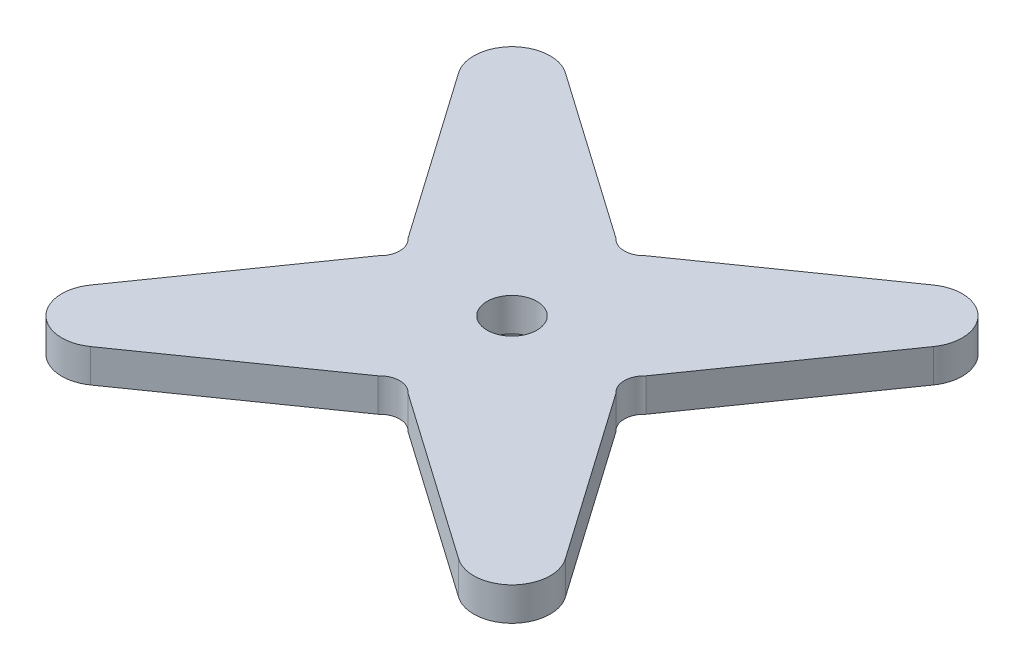
from build123d import *

# Parameters (mm, degrees)
BOSS_EXTRUDE1_DEPTH = 2
SKETCH2_R           = 4
SKETCH2_R_2         = 3
BOSS_EXTRUDE2_DEPTH = 3.5
FILLET1_R           = 2.5
SKETCH3_R           = 1.5
CUT_EXTRUDE1_DEPTH  = 2


with BuildPart() as part:
    # Sketch1 → Boss-Extrude1 (new body)
    with BuildSketch(Plane(origin=(0, 0, 0), x_dir=(1, 0, 0), z_dir=(0, 1, 0))):
        with BuildLine():
            Line((-24.810790305, 12.959420841), (-17.699288905, 2.803144292))
            ThreePointArc((-17.699288905, 2.803144292), (-17.300062844, 1.904277974), (-17.699288905, 1.005411656))
            Line((-17.699288905, 1.005411656), (-24.810790305, -9.150864893))
            ThreePointArc((-24.810790305, -9.150864893), (-24.5530862, -12.096436293), (-21.6075148, -12.354140399))
            Line((-21.6075148, -12.354140399), (-11.45123825, -5.242638998))
            ThreePointArc((-11.45123825, -5.242638998), (-10.552371933, -4.843412937), (-9.653505615, -5.242638998))
            Line((-9.653505615, -5.242638998), (0.502770934, -12.354140399))
            ThreePointArc((0.502770934, -12.354140399), (3.448342335, -12.096436293), (3.70604644, -9.150864893))
            Line((3.70604644, -9.150864893), (-3.40545496, 1.005411656))
            ThreePointArc((-3.40545496, 1.005411656), (-3.804681022, 1.904277974), (-3.40545496, 2.803144292))
            Line((-3.40545496, 2.803144292), (3.70604644, 12.959420841))
            ThreePointArc((3.70604644, 12.959420841), (3.448342335, 15.904992242), (0.502770934, 16.162696347))
            Line((0.502770934, 16.162696347), (-9.653505615, 9.051194947))
            ThreePointArc((-9.653505615, 9.051194947), (-10.552371933, 8.651968885), (-11.45123825, 9.051194947))
            Line((-11.45123825, 9.051194947), (-21.6075148, 16.162696347))
            ThreePointArc((-21.6075148, 16.162696347), (-24.5530862, 15.904992242), (-24.810790305, 12.959420841))
        make_face()
    extrude(amount=BOSS_EXTRUDE1_DEPTH)

    # Sketch2 → Boss-Extrude2 (add)
    with BuildSketch(Plane.XZ):
        with Locations(Location((-10.552371933, -1.904277974, 0), (0, 0, 90))):
            Circle(SKETCH2_R)
        with Locations(Location((-10.552371933, -1.904277974, 0), (0, 0, 270))):
            Circle(SKETCH2_R_2, mode=Mode.SUBTRACT)
    extrude(amount=BOSS_EXTRUDE2_DEPTH)

    # Fillet1
    fillet1_edges = [part.edges().sort_by_distance(p)[0] for p in [
        (-10.552371933, 0, -5.904277974),
    ]]
    fillet(fillet1_edges, radius=FILLET1_R)

    # Sketch3 → Cut-Extrude1 (cut)
    with BuildSketch(Plane.XZ):
        with Locations(Location((-10.552371933, -1.904277974, 0), (0, 0, 270))):
            Circle(SKETCH3_R)
    extrude(amount=-CUT_EXTRUDE1_DEPTH, mode=Mode.SUBTRACT)


solid = part.part
